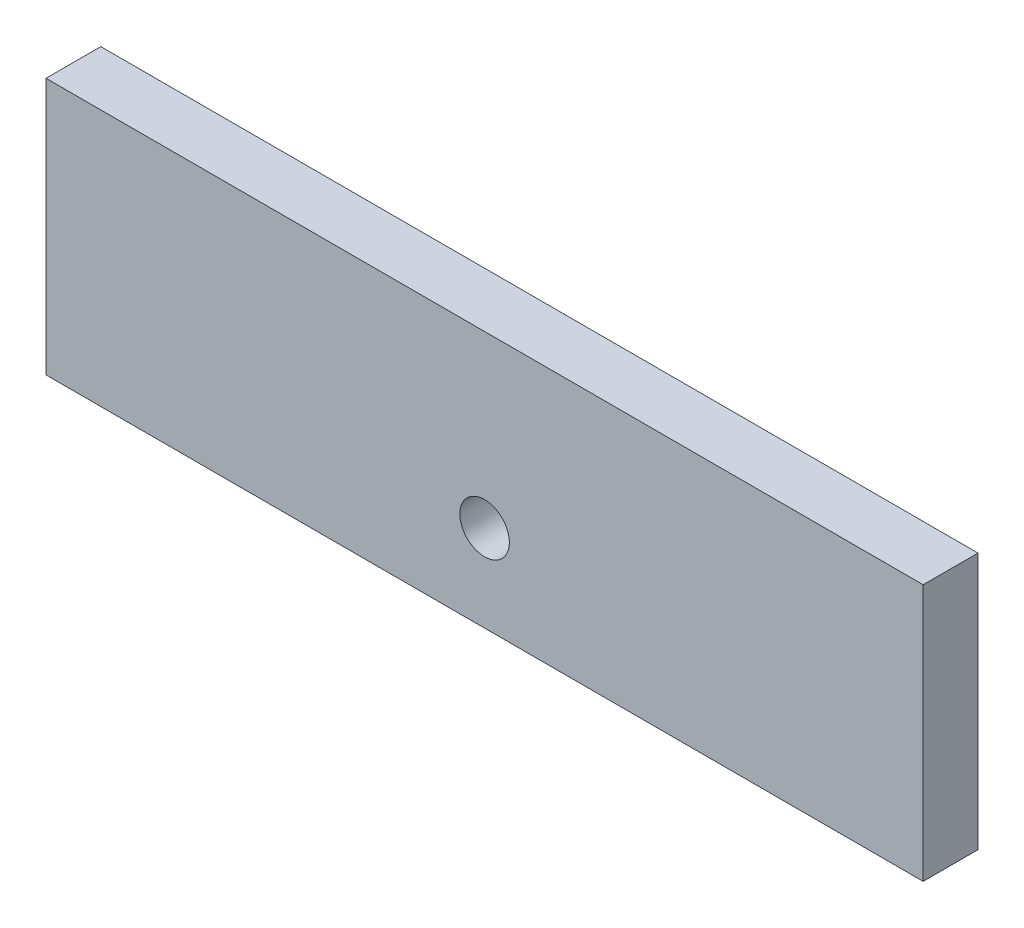
from build123d import *

# Parameters (mm, degrees)
SKETCH1_W           = 101.6
SKETCH1_H           = 29.7561
BOSS_EXTRUDE1_DEPTH = 6.35
SKETCH2_R           = 2.8702
CUT_EXTRUDE1_DEPTH  = 107.058040653


with BuildPart() as part:
    # Sketch1 → Boss-Extrude1 (new body)
    with BuildSketch(Plane.XY):
        with Locations((50.8, 14.87805)):
            Rectangle(SKETCH1_W, SKETCH1_H)
    extrude(amount=-BOSS_EXTRUDE1_DEPTH)

    # Sketch2 → Cut-Extrude1 (cut, through all)
    with BuildSketch(Plane.XY):
        with Locations((50.8, 10.02665)):
            Circle(SKETCH2_R)
    extrude(amount=-CUT_EXTRUDE1_DEPTH, mode=Mode.SUBTRACT)


solid = part.part
